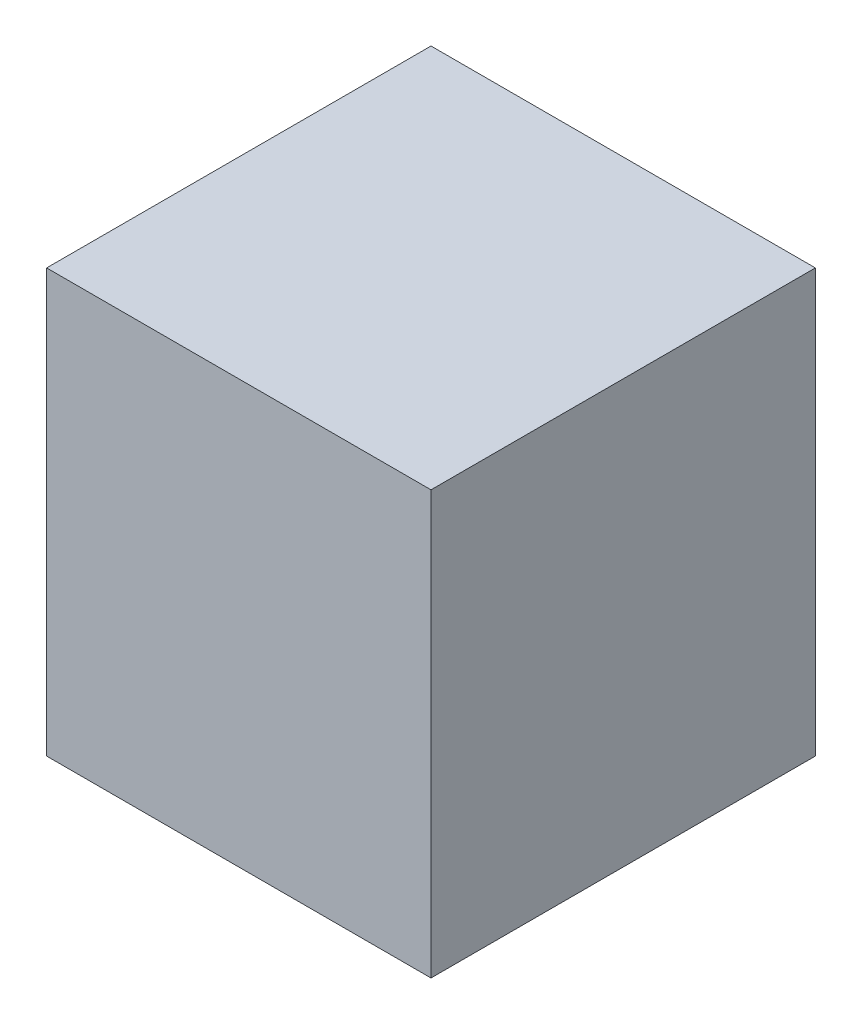
from build123d import *

# Parameters (mm, degrees)
SKETCH1_W           = 10
SKETCH1_H           = 10
BOSS_EXTRUDE1_DEPTH = 11


with BuildPart() as part:
    # Sketch1 → Boss-Extrude1 (new body)
    with BuildSketch(Plane(origin=(0, 0, 0), x_dir=(1, 0, 0), z_dir=(0, 1, 0))):
        Rectangle(SKETCH1_W, SKETCH1_H)
    extrude(amount=BOSS_EXTRUDE1_DEPTH)


solid = part.part
